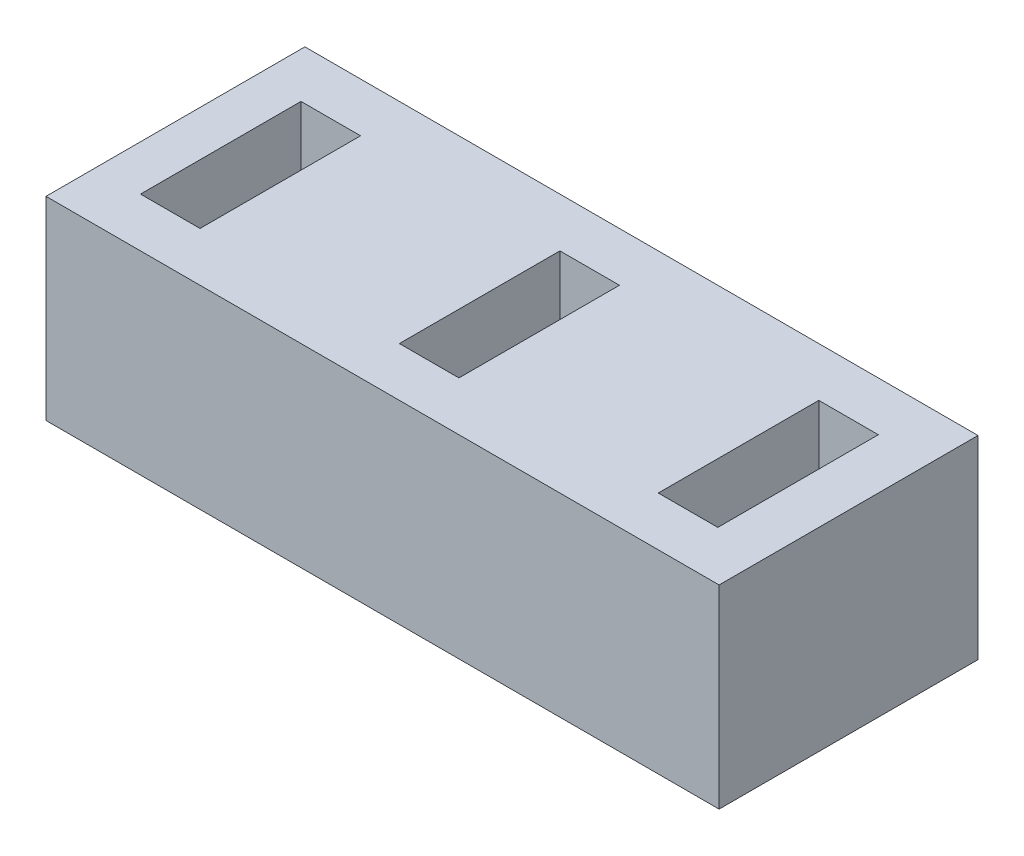
from build123d import *

# Parameters (mm, degrees)
CROQUIS1_W              = 52
CROQUIS1_H              = 20
SALIENTE_EXTRUIR1_DEPTH = 15
CROQUIS2_W              = 4.6
CROQUIS2_H              = 12.4
CORTAR_EXTRUIR1_DEPTH   = 58.697486947


with BuildPart() as part:
    # Croquis1 → Saliente-Extruir1 (new body)
    with BuildSketch(Plane(origin=(0, 0, 0), x_dir=(1, 0, 0), z_dir=(0, 1, 0))):
        with Locations((26, 10)):
            Rectangle(CROQUIS1_W, CROQUIS1_H)
    extrude(amount=SALIENTE_EXTRUIR1_DEPTH)

    # Croquis2 → Cortar-Extruir1 (cut, through all)
    with BuildSketch(Plane(origin=(0, 15, 0), x_dir=(1, 0, 0), z_dir=(0, 1, 0))):
        with Locations((5.8, 10)):
            Rectangle(CROQUIS2_W, CROQUIS2_H)
        with Locations((45.8, 10)):
            Rectangle(CROQUIS2_W, CROQUIS2_H)
        with Locations((25.8, 10)):
            Rectangle(CROQUIS2_W, CROQUIS2_H)
    extrude(amount=-CORTAR_EXTRUIR1_DEPTH, mode=Mode.SUBTRACT)


solid = part.part
